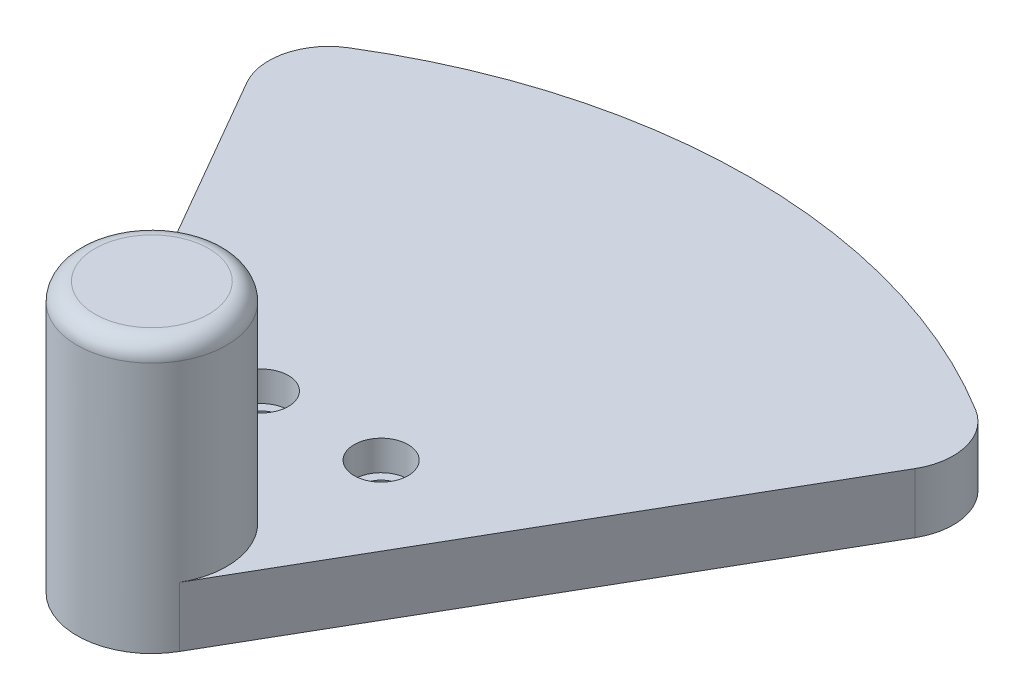
from build123d import *

# Parameters (mm, degrees)
BOSS_EXTRUDE1_DEPTH = 10
SKETCH2_R           = 4.5
CUT_EXTRUDE1_DEPTH  = 5
SKETCH3_R           = 3
CUT_EXTRUDE2_DEPTH  = 116.610810509
SKETCH4_R           = 12.5
BOSS_EXTRUDE2_DEPTH = 35
FILLET1_R           = 3


with BuildPart() as part:
    # Sketch1 → Boss-Extrude1 (new body)
    with BuildSketch(Plane(origin=(0, 0, 0), x_dir=(1, 0, 0), z_dir=(0, 1, 0))):
        with BuildLine():
            Line((-10.825317547, -6.25), (-55.807953086, 71.662210211))
            ThreePointArc((-55.807953086, 71.662210211), (-56.841976003, 79.115981661), (-52.386332276, 85.180233568))
            ThreePointArc((-52.386332276, 85.180233568), (0, 100), (52.386332276, 85.180233568))
            ThreePointArc((52.386332276, 85.180233568), (56.841976003, 79.115981661), (55.807953086, 71.662210211))
            Line((55.807953086, 71.662210211), (10.825317547, -6.25))
            ThreePointArc((10.825317547, -6.25), (0, -12.5), (-10.825317547, -6.25))
        make_face()
    extrude(amount=BOSS_EXTRUDE1_DEPTH)

    # Sketch2 → Cut-Extrude1 (cut)
    with BuildSketch(Plane(origin=(0, 10, 0), x_dir=(1, 0, 0), z_dir=(0, 1, 0))):
        with Locations(Location((10, 28.284271247, 0), (0, 0, 270))):
            Circle(SKETCH2_R)
        with Locations(Location((-10, 28.284271247, 0), (0, 0, 90))):
            Circle(SKETCH2_R)
    extrude(amount=-CUT_EXTRUDE1_DEPTH, mode=Mode.SUBTRACT)

    # Sketch3 → Cut-Extrude2 (cut, through all)
    with BuildSketch(Plane(origin=(0, 10, 0), x_dir=(1, 0, 0), z_dir=(0, 1, 0))):
        with Locations(Location((10, 28.284271247, 0), (0, 0, 270))):
            Circle(SKETCH3_R)
        with Locations(Location((-10, 28.284271247, 0), (0, 0, 90))):
            Circle(SKETCH3_R)
    extrude(amount=-CUT_EXTRUDE2_DEPTH, mode=Mode.SUBTRACT)

    # Sketch4 → Boss-Extrude2 (add)
    with BuildSketch(Plane(origin=(0, 10, 0), x_dir=(1, 0, 0), z_dir=(0, 1, 0))):
        with Locations(Location((0, 0, 0), (0, 0, 330))):
            Circle(SKETCH4_R)
    extrude(amount=BOSS_EXTRUDE2_DEPTH)

    # Fillet1
    fillet1_edges = [part.edges().sort_by_distance(p)[0] for p in [
        (-10.825317547, 45, -6.25),
    ]]
    fillet(fillet1_edges, radius=FILLET1_R)


solid = part.part
